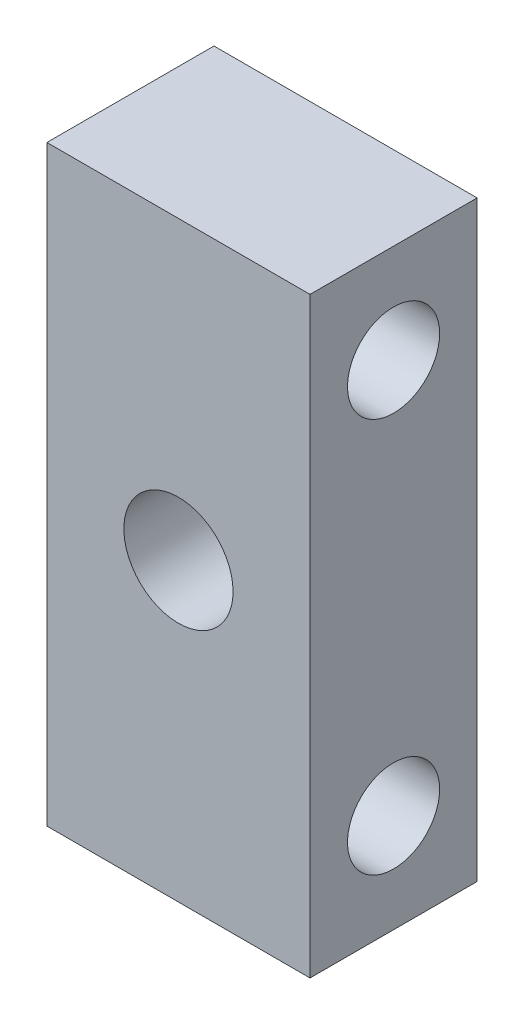
from build123d import *

# Parameters (mm, degrees)
SKETCH1_W           = 20
SKETCH1_H           = 45
BOSS_EXTRUDE1_DEPTH = 12.7
SKETCH2_R           = 4.15
CUT_EXTRUDE1_DEPTH  = 28.704512268
SKETCH3_R           = 3.5
CUT_EXTRUDE2_DEPTH  = 33.673230633


with BuildPart() as part:
    # Sketch1 → Boss-Extrude1 (new body)
    with BuildSketch(Plane.XY):
        Rectangle(SKETCH1_W, SKETCH1_H)
    extrude(amount=BOSS_EXTRUDE1_DEPTH)

    # Sketch2 → Cut-Extrude1 (cut, through all)
    with BuildSketch(Plane.XY.offset(12.7)):
        Circle(SKETCH2_R)
    extrude(amount=-CUT_EXTRUDE1_DEPTH, mode=Mode.SUBTRACT)

    # Sketch3 → Cut-Extrude2 (cut, through all)
    with BuildSketch(Plane(origin=(10, 0, 0), x_dir=(0, 0, -1), z_dir=(1, 0, 0))):
        with Locations((-6.35, 15)):
            Circle(SKETCH3_R)
        with Locations((-6.35, -15)):
            Circle(SKETCH3_R)
    extrude(amount=-CUT_EXTRUDE2_DEPTH, mode=Mode.SUBTRACT)


solid = part.part
